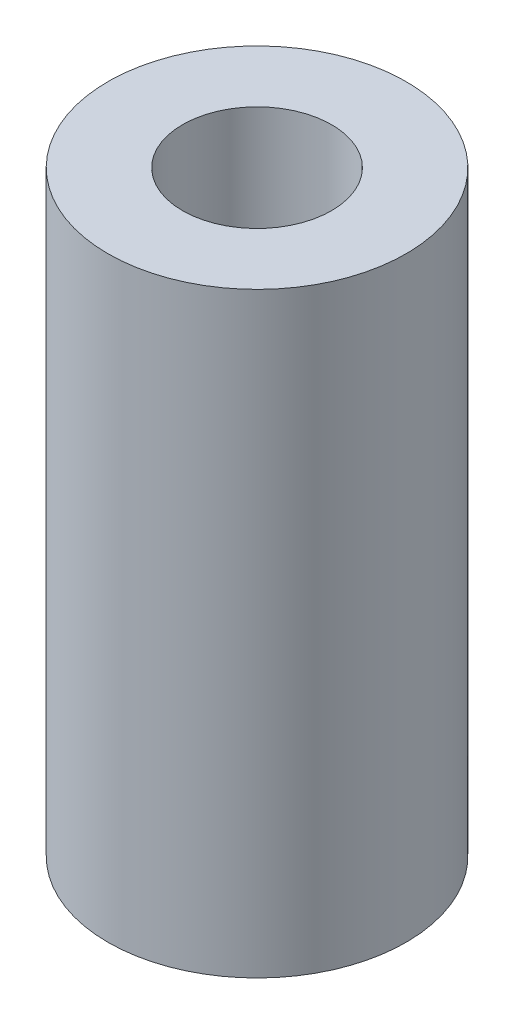
from build123d import *

# Parameters (mm, degrees)
SKETCH1_R             = 2.5
BOSS_EXTRUDE1_DEPTH   = 10
M3X0_5_TAPPED_HOLE1_D = 2.5


with BuildPart() as part:
    # Sketch1 → Boss-Extrude1 (new body)
    with BuildSketch(Plane(origin=(0, 0, 0), x_dir=(1, 0, 0), z_dir=(0, 1, 0))):
        with Locations(Location((0, 0, 0), (0, 0, 270))):
            Circle(SKETCH1_R)
    extrude(amount=BOSS_EXTRUDE1_DEPTH)

    # M3x0.5 Tapped Hole1 (through all)
    with Locations(Plane(origin=(0, 10, 0), x_dir=(1, 0, 0), z_dir=(0, 1, 0))):
        with Locations((0, 0)):
            Hole(M3X0_5_TAPPED_HOLE1_D / 2)


solid = part.part
